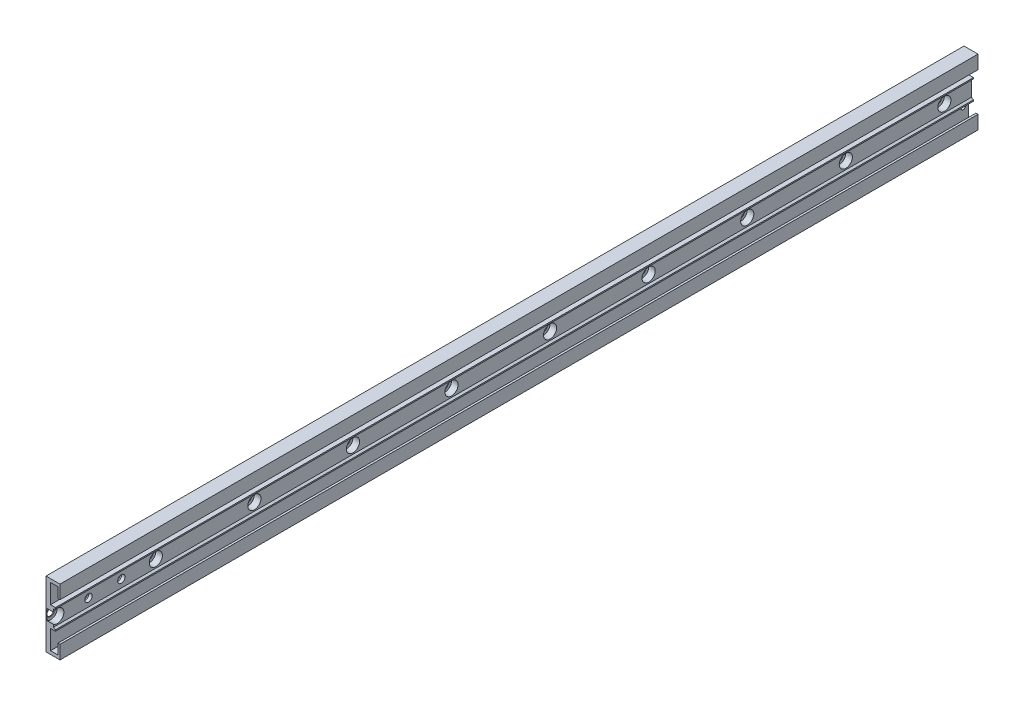
from build123d import *

# Parameters (mm, degrees)
BOSS_EXTRUDE1_DEPTH                             = 281.94
BOSS_EXTRUDE1_DEPTH_BACK                        = 276.86
CBORE_FOR_M4_SHCS1_D                            = 4.5
CBORE_FOR_M4_SHCS1_CBORE_D                      = 8
CBORE_FOR_M4_SHCS1_CBORE_DEPTH                  = 4
CSK_FOR_M4_FLAT_HEAD_MACHINE_SCREW1_D           = 4.5
CSK_FOR_M4_FLAT_HEAD_MACHINE_SCREW1_CSINK_D     = 9.4
CSK_FOR_M4_FLAT_HEAD_MACHINE_SCREW1_CSINK_ANGLE = 90
LPATTERN1_COUNT                                 = 9
LPATTERN1_PITCH                                 = 60
LPATTERN1_COL_COUNT                             = 2
LPATTERN1_COL_PITCH                             = 60
F_6_32_TAPPED_HOLE1_D                           = 2.7051


with BuildPart() as part:
    # Sketch1 → Boss-Extrude1 (new, two sides: drawn at the far end of the back side and taken through both)
    with BuildSketch(Plane.XY.offset(-BOSS_EXTRUDE1_DEPTH_BACK)):
        Polygon((-39.1, 20), (-39.1, 11.75), (-40.375, 11.75), (-40.375, 18), (-44.875, 18), (-44.875, 6.25), (-41.875, 6.25), (-41.875, 5.5), (-43.125, 4.778312164), (-43.125, -4.778312164), (-41.875, -5.5), (-41.875, -6.25), (-44.875, -6.25), (-44.875, -18), (-40.375, -18), (-40.375, -11.75), (-39.1, -11.75), (-39.1, -20), (-47.625, -20), (-47.625, 20), align=None)
    extrude(amount=BOSS_EXTRUDE1_DEPTH + BOSS_EXTRUDE1_DEPTH_BACK)

    # CBORE for M4 SHCS1 (through all)
    with Locations(Plane(origin=(-43.125, 0, 0), x_dir=(0, 0, -1), z_dir=(1, 0, 0))):
        with Locations((-219.589999986, 0)):
            cbore_for_m4_shcs1 = CounterBoreHole(CBORE_FOR_M4_SHCS1_D / 2, CBORE_FOR_M4_SHCS1_CBORE_D / 2, CBORE_FOR_M4_SHCS1_CBORE_DEPTH)

    # CSK for M4 Flat Head Machine Screw1 (through all)
    with Locations(Plane(origin=(-47.625, 10.717833064, -20.25819937), x_dir=(0, 0, -1), z_dir=(-1, 0, 0))):
        with Locations((-260.84819952, 10.717833064), (-280.848199398, 10.717833064)):
            CounterSinkHole(CSK_FOR_M4_FLAT_HEAD_MACHINE_SCREW1_D / 2, CSK_FOR_M4_FLAT_HEAD_MACHINE_SCREW1_CSINK_D / 2, counter_sink_angle=CSK_FOR_M4_FLAT_HEAD_MACHINE_SCREW1_CSINK_ANGLE)

    # LPattern1: CBORE for M4 SHCS1 ×9
    with Locations(*[(0, 0, -i * LPATTERN1_PITCH) for i in range(1, LPATTERN1_COUNT)]):
        add(cbore_for_m4_shcs1, mode=Mode.SUBTRACT)

    # LPattern1 col: CBORE for M4 SHCS1 ×2
    with Locations(*[(0, 0, i * LPATTERN1_COL_PITCH) for i in range(1, LPATTERN1_COL_COUNT)]):
        add(cbore_for_m4_shcs1, mode=Mode.SUBTRACT)

    # #6-32 Tapped Hole1 (through all)
    with Locations(Plane(origin=(-44.875, 0, 0), x_dir=(0, 0, -1), z_dir=(1, 0, 0))):
        with Locations((273.685, -9.250000096), (273.685, 9.250000096)):
            Hole(F_6_32_TAPPED_HOLE1_D / 2)


solid = part.part
